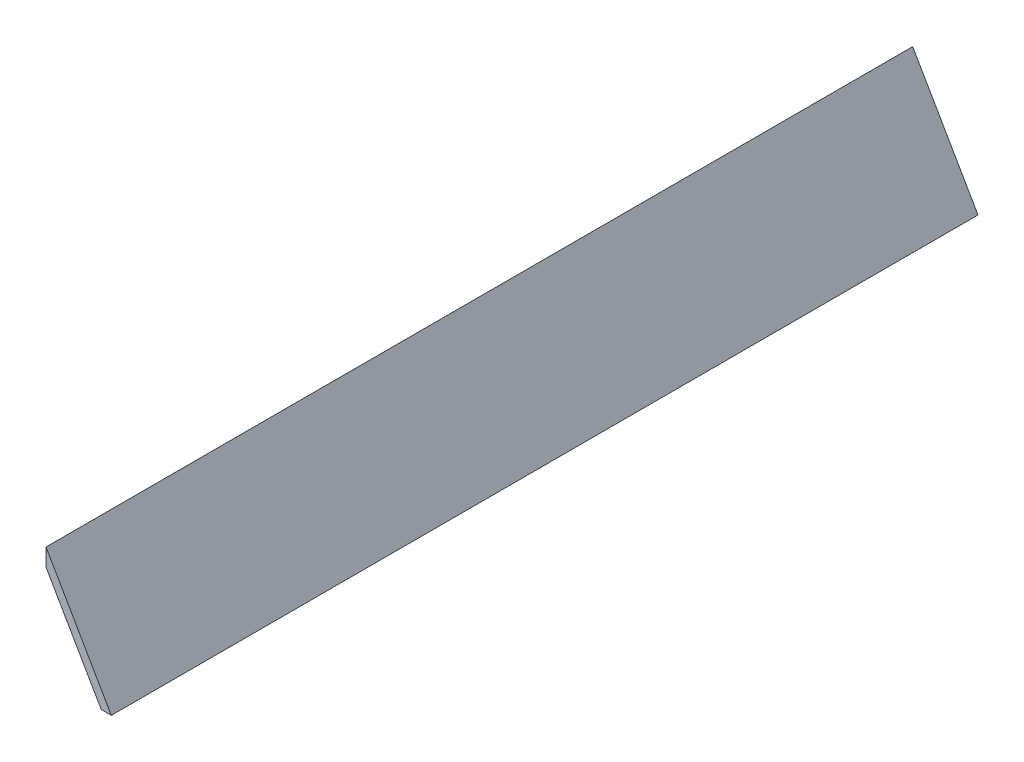
from build123d import *

# Parameters (mm, degrees)
SALIENTE_EXTRUIR2_DEPTH = 99.5


with BuildPart() as part:
    # Croquis2 → Saliente-Extruir2 (new body)
    with BuildSketch(Plane.XY):
        Polygon((-2, 95.998889197), (-2, 97.998889197), (5.497094433, 85.006831044), (4.341572012, 85.006831044), align=None)
    extrude(amount=-SALIENTE_EXTRUIR2_DEPTH)


solid = part.part
